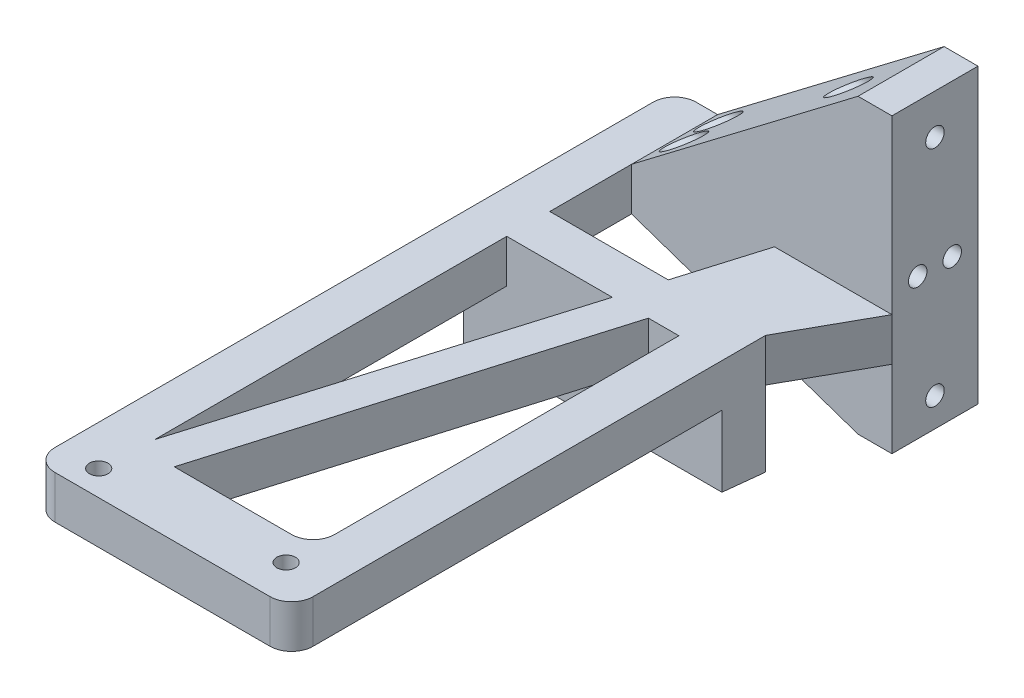
from build123d import *

# Parameters (mm, degrees)
EXTRUDE_1_DEPTH                 = 10
SKETCH_4_W                      = 7.875
SKETCH_4_H                      = 20
EXTRUDE_2_DEPTH                 = 40
CUT_EXTRUDE_1_REACH             = 116.35
SKETCH_5_R                      = 2.15
CUT_EXTRUDE_1_DIRECTION_2_DEPTH = 53
CUT_EXTRUDE_2_REACH             = 107.272
SKETCH_6_R                      = 2.15
FILLET_1_R                      = 5
FILLET_2_R                      = 5
SKETCH_7_W                      = 7.875
SKETCH_7_H                      = 20
EXTRUDE_3_DEPTH                 = 18
CUT_EXTRUDE_3_REACH             = 116.35
SKETCH_8_R                      = 2.15
EXTRUDE_8_DEPTH                 = 20
SKETCH_15_W                     = 52.625
SKETCH_15_H                     = 20
EXTRUDE_9_DEPTH                 = 40
CUT_EXTRUDE_START               = -7.875
SKETCH_14_R                     = 3.5
CUT_EXTRUDE_8_DEPTH             = 54
CUT_EXTRUDE_10_DEPTH            = 20
EXTRUDE_10_DEPTH                = 10
EXTRUDE_11_DEPTH                = 17.5
CUT_EXTRUDE_11_DEPTH            = 64


with BuildPart() as part:
    # 草图1 → 凸台-拉伸1 (new body)
    with BuildSketch(Plane(origin=(0, 0, 0), x_dir=(1, 0, 0), z_dir=(0, 1, 0))):
        Polygon((5.931150433, 81.572237736), (53.180774799, 81.572237736), (53.180774799, 61.572237736), (42.680774799, 42.721022935), (42.680774799, 31.757290204), (42.680774799, -57.600660719), (42.680774799, -67.427762264), (0.431150433, -67.427762264), (-17.319225201, -67.427762264), (-17.319225201, 81.572237736), align=None)
        Polygon((47.930774799, 61.572237736), (42.680774799, 61.572237736), (42.680774799, 52.689495612), align=None, mode=Mode.SUBTRACT)
        Polygon((25.906315323, 61.572237736), (-7.319225201, 61.572237736), (-7.319225201, -49.220735683), align=None, mode=Mode.SUBTRACT)
        Polygon((0.431150433, -52.427762264), (32.680774799, -52.427762264), (32.680774799, 56.508121895), align=None, mode=Mode.SUBTRACT)
    extrude(amount=EXTRUDE_1_DEPTH)

    # 草图4 → 凸台-拉伸2 (add)
    with BuildSketch(Plane(origin=(0, 10, 0), x_dir=(1, 0, 0), z_dir=(0, 1, 0))):
        with Locations((49.243274799, 71.572237736)):
            Rectangle(SKETCH_4_W, SKETCH_4_H)
    extrude(amount=EXTRUDE_2_DEPTH)

    # 草图5 → 切除-拉伸1 (cut, up to next)
    with BuildSketch(Plane.ZY.offset(-45.305774799), mode=Mode.PRIVATE) as cut_extrude_1_sk1:
        with Locations(Location((-75.572237736, 14.7, 0), (0, 0, 180))):
            Circle(SKETCH_5_R)
    cut_extrude_1_tool1 = extrude(cut_extrude_1_sk1.sketch, amount=-CUT_EXTRUDE_1_REACH, mode=Mode.PRIVATE) & part.part
    # 草图5 → 切除-拉伸1 (cut, up to next)
    with BuildSketch(Plane.ZY.offset(-45.305774799), mode=Mode.PRIVATE) as cut_extrude_1_sk2:
        with Locations(Location((-67.572237736, 14.7, 0), (0, 0, 180))):
            Circle(SKETCH_5_R)
    cut_extrude_1_tool2 = extrude(cut_extrude_1_sk2.sketch, amount=-CUT_EXTRUDE_1_REACH, mode=Mode.PRIVATE) & part.part
    # 草图5 → 切除-拉伸1 (cut, up to next)
    with BuildSketch(Plane.ZY.offset(-45.305774799), mode=Mode.PRIVATE) as cut_extrude_1_sk3:
        with Locations(Location((-71.572237736, 40.7, 0), (0, 0, 180))):
            Circle(SKETCH_5_R)
    cut_extrude_1_tool3 = extrude(cut_extrude_1_sk3.sketch, amount=-CUT_EXTRUDE_1_REACH, mode=Mode.PRIVATE) & part.part
    add(cut_extrude_1_tool1.solids().sort_by_distance((45.305775, 14.7, -75.572238))[0], mode=Mode.SUBTRACT)
    add(cut_extrude_1_tool2.solids().sort_by_distance((45.305775, 14.7, -67.572238))[0], mode=Mode.SUBTRACT)
    add(cut_extrude_1_tool3.solids().sort_by_distance((45.305775, 40.7, -71.572238))[0], mode=Mode.SUBTRACT)

    # 草图5 → 切除-拉伸1 direction 2 (cut)
    with BuildSketch(Plane.ZY.offset(-45.305774799)):
        with Locations(Location((-75.572237736, 14.7, 0), (0, 0, 180))):
            Circle(SKETCH_5_R)
        with Locations(Location((-67.572237736, 14.7, 0), (0, 0, 180))):
            Circle(SKETCH_5_R)
        with Locations(Location((-71.572237736, 40.7, 0), (0, 0, 180))):
            Circle(SKETCH_5_R)
    extrude(amount=CUT_EXTRUDE_1_DIRECTION_2_DEPTH, mode=Mode.SUBTRACT)

    # 草图6 → 切除-拉伸2 (cut, up to next)
    with BuildSketch(Plane(origin=(0, 10, 0), x_dir=(1, 0, 0), z_dir=(0, 1, 0)), mode=Mode.PRIVATE) as cut_extrude_2_sk1:
        with Locations(Location((-8.019225201, -61.542634482, 0), (0, 0, 270))):
            Circle(SKETCH_6_R)
    cut_extrude_2_tool1 = extrude(cut_extrude_2_sk1.sketch, amount=-CUT_EXTRUDE_2_REACH, mode=Mode.PRIVATE) & part.part
    # 草图6 → 切除-拉伸2 (cut, up to next)
    with BuildSketch(Plane(origin=(0, 10, 0), x_dir=(1, 0, 0), z_dir=(0, 1, 0)), mode=Mode.PRIVATE) as cut_extrude_2_sk2:
        with Locations(Location((32.680774799, -58.692634482, 0), (0, 0, 270))):
            Circle(SKETCH_6_R)
    cut_extrude_2_tool2 = extrude(cut_extrude_2_sk2.sketch, amount=-CUT_EXTRUDE_2_REACH, mode=Mode.PRIVATE) & part.part
    add(cut_extrude_2_tool1.solids().sort_by_distance((-8.019225, 10, 61.542634))[0], mode=Mode.SUBTRACT)
    add(cut_extrude_2_tool2.solids().sort_by_distance((32.680775, 10, 58.692634))[0], mode=Mode.SUBTRACT)

    # 圆角1
    fillet_1_edges = [part.edges().sort_by_distance(p)[0] for p in [
        (-17.319225201, 5, 67.427762264),
        (-17.319225201, 5, -81.572237736),
        (42.680774799, 5, 67.427762264),
    ]]
    fillet(fillet_1_edges, radius=FILLET_1_R)

    # 圆角2
    fillet_2_edges = [part.edges().sort_by_distance(p)[0] for p in [
        (32.680774799, 5, 52.427762264),
    ]]
    fillet(fillet_2_edges, radius=FILLET_2_R)

    # 草图7 → 凸台-拉伸3 (add)
    with BuildSketch(Plane.XZ):
        with Locations((49.243274799, -71.572237736)):
            Rectangle(SKETCH_7_W, SKETCH_7_H)
    extrude(amount=EXTRUDE_3_DEPTH)

    # 草图8 → 切除-拉伸3 (cut, up to next)
    with BuildSketch(Plane.ZY.offset(-45.305774799), mode=Mode.PRIVATE) as cut_extrude_3_sk1:
        with Locations((-71.572237736, -11.3)):
            Circle(SKETCH_8_R)
    cut_extrude_3_tool1 = extrude(cut_extrude_3_sk1.sketch, amount=-CUT_EXTRUDE_3_REACH, mode=Mode.PRIVATE) & part.part
    add(cut_extrude_3_tool1.solids().sort_by_distance((45.305775, -11.3, -71.572238))[0], mode=Mode.SUBTRACT)

    # 草图13 → 凸台-拉伸8 (add)
    with BuildSketch(Plane.XY.offset(-61.572237736)):
        Polygon((45.305774799, 0), (45.305774799, -18), (-7.319225201, 0), align=None)
    extrude(amount=-EXTRUDE_8_DEPTH)

    # 草图15 → 凸台-拉伸9 (add)
    with BuildSketch(Plane(origin=(0, 10, 0), x_dir=(1, 0, 0), z_dir=(0, 1, 0))):
        with Locations((18.993274799, 71.572237736)):
            Rectangle(SKETCH_15_W, SKETCH_15_H)
    extrude(amount=EXTRUDE_9_DEPTH)

    # 草图14 → 切除-拉伸8 (cut)
    with BuildSketch(Plane(origin=(53.180774799, 0, 0), x_dir=(0, 0, -1), z_dir=(1, 0, 0)).offset(CUT_EXTRUDE_START)):
        with Locations((71.572237736, 40.7)):
            Circle(SKETCH_14_R)
        with Locations((67.572237736, 14.7)):
            Circle(SKETCH_14_R)
        with Locations((75.572237736, 14.7)):
            Circle(SKETCH_14_R)
        with Locations((71.572237736, -11.3)):
            Circle(SKETCH_14_R)
    extrude(amount=-CUT_EXTRUDE_8_DEPTH, mode=Mode.SUBTRACT)

    # 草图17 → 切除-拉伸10 (cut)
    with BuildSketch(Plane.XY.offset(-61.572237736)):
        Polygon((-7.319225201, 10), (-7.319225201, 50), (45.305774799, 50), align=None)
    extrude(amount=-CUT_EXTRUDE_10_DEPTH, mode=Mode.SUBTRACT)

    # 草图18 → 凸台-拉伸10 (add)
    with BuildSketch(Plane(origin=(0, 10, 0), x_dir=(1, 0, 0), z_dir=(0, 1, 0))):
        Polygon((-7.319225201, 32.572237736), (17.209548321, 32.572237736), (20.208433494, 42.572237736), (-7.319225201, 42.572237736), align=None)
        Polygon((25.594741772, 32.572237736), (32.680774799, 32.572237736), (32.680774799, 56.508121895), align=None)
        Polygon((42.680774799, 61.572237736), (42.680774799, 52.689495612), (47.930774799, 61.572237736), align=None)
    extrude(amount=-EXTRUDE_10_DEPTH)

    # 草图19 → 凸台-拉伸11 (add)
    with BuildSketch(Plane.XZ):
        Polygon((-17.319225201, -32.572237736), (-17.319225201, -42.572237736), (42.680774799, -42.721022935), (42.680774799, -32.572237736), align=None)
    extrude(amount=EXTRUDE_11_DEPTH)

    # 草图20 → 切除-拉伸11 (cut)
    with BuildSketch(Plane.ZY.offset(17.319225201)):
        Polygon((-42.572237736, -17.5), (-32.572237736, -17.5), (-32.572237736, -16.5), align=None)
    extrude(amount=-CUT_EXTRUDE_11_DEPTH, mode=Mode.SUBTRACT)


solid = part.part
